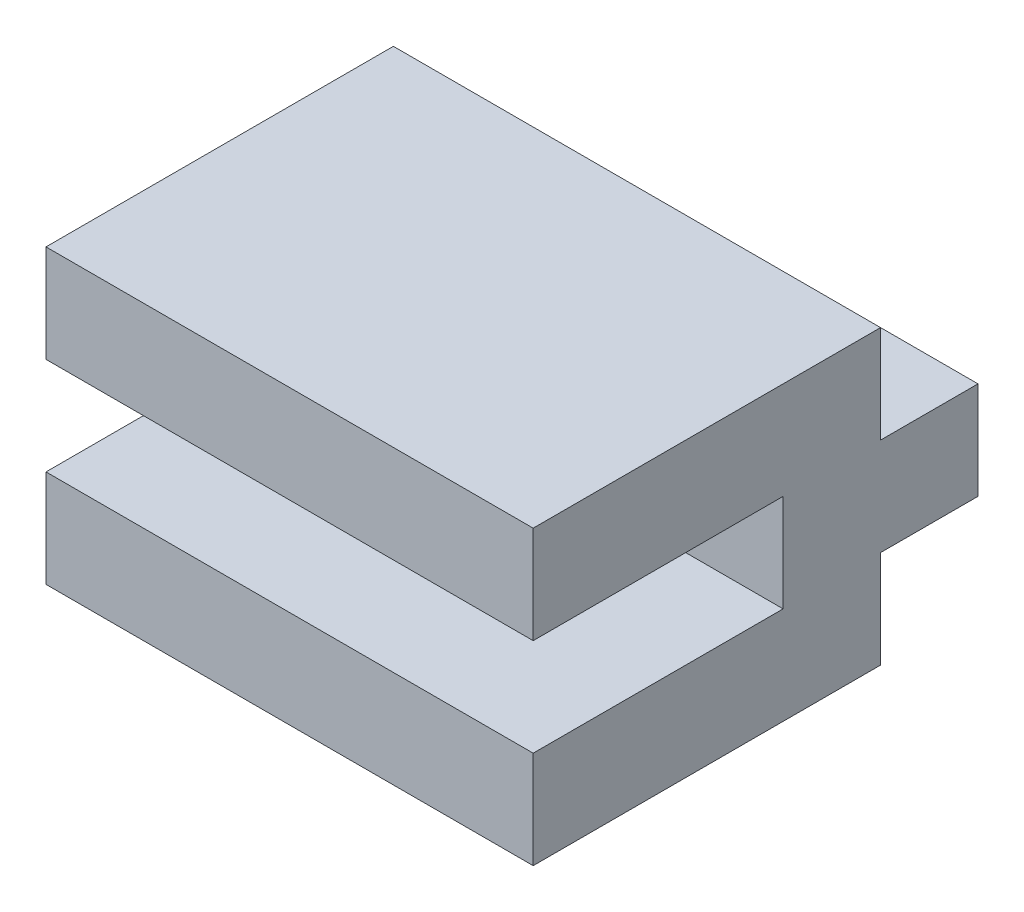
from build123d import *

# Parameters (mm, degrees)
BOSS_EXTRUDE1_DEPTH = 10


with BuildPart() as part:
    # Sketch1 → Boss-Extrude1 (new body)
    with BuildSketch(Plane(origin=(0, 0, 0), x_dir=(0, 0, -1), z_dir=(1, 0, 0))):
        Polygon((3.565284374, -3), (-3.565284374, -3), (-3.565284374, -1), (1.565284374, -1), (1.565284374, 1), (-3.565284374, 1), (-3.565284374, 3), (3.565284374, 3), (3.565284374, 1), (5.565284374, 1), (5.565284374, -1), (3.565284374, -1), align=None)
    extrude(amount=BOSS_EXTRUDE1_DEPTH)


solid = part.part
